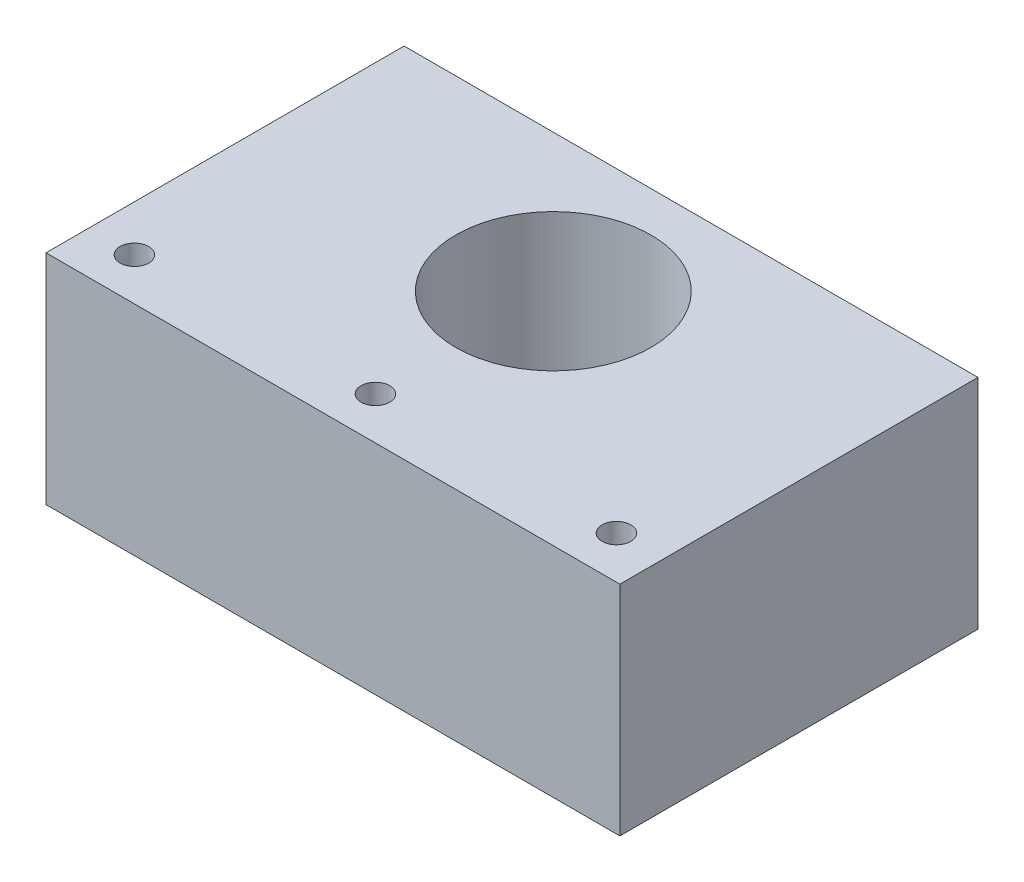
from build123d import *

# Parameters (mm, degrees)
SKETCH1_W           = 63.5
SKETCH1_H           = 25.4
BOSS_EXTRUDE1_DEPTH = 38.1
SKETCH2_R           = 3.175
CUT_EXTRUDE1_DEPTH  = 12.7
SKETCH2_3_R         = 8.763
CUT_EXTRUDE2_DEPTH  = 4.826
CUT_EXTRUDE3_START  = -20.574
SKETCH3_R           = 6.35
CUT_EXTRUDE3_DEPTH  = 20.574
SKETCH4_R           = 10.795
CUT_EXTRUDE4_DEPTH  = 19.05
SKETCH5_R           = 1.5875
CUT_EXTRUDE5_DEPTH  = 50.8
SKETCH6_W           = 63.5
SKETCH6_H           = 1.27
CUT_EXTRUDE6_DEPTH  = 38.1
SKETCH7_W           = 63.5
SKETCH7_H           = 24.13
BOSS_EXTRUDE2_DEPTH = 1.524


with BuildPart() as part:
    # Sketch1 → Boss-Extrude1 (new body)
    with BuildSketch(Plane.XY):
        Rectangle(SKETCH1_W, SKETCH1_H)
    extrude(amount=BOSS_EXTRUDE1_DEPTH)

    # Sketch2 → Cut-Extrude1 (cut)
    with BuildSketch(Plane.XZ.offset(12.7)):
        with Locations(Location((-24.765, 15.24, 0), (0, 0, 270))):
            Circle(SKETCH2_R)
        with Locations(Location((24.765, 15.24, 0), (0, 0, 270))):
            Circle(SKETCH2_R)
    extrude(amount=-CUT_EXTRUDE1_DEPTH, mode=Mode.SUBTRACT)

    # Sketch2<3> → Cut-Extrude2 (cut)
    with BuildSketch(Plane.XZ.offset(12.7)):
        with Locations(Location((0, 15.24, 0), (0, 0, 270))):
            Circle(SKETCH2_3_R)
    extrude(amount=-CUT_EXTRUDE2_DEPTH, mode=Mode.SUBTRACT)

    # Sketch3 → Cut-Extrude3 (cut)
    with BuildSketch(Plane.XZ.offset(7.874).offset(CUT_EXTRUDE3_START)):
        with Locations(Location((0, 15.24, 0), (0, 0, 270))):
            Circle(SKETCH3_R)
    extrude(amount=CUT_EXTRUDE3_DEPTH, mode=Mode.SUBTRACT)

    # Sketch4 → Cut-Extrude4 (cut)
    with BuildSketch(Plane(origin=(0, 12.7, 0), x_dir=(1, 0, 0), z_dir=(0, 1, 0))):
        with Locations(Location((0, -15.24, 0), (0, 0, 270))):
            Circle(SKETCH4_R)
    extrude(amount=-CUT_EXTRUDE4_DEPTH, mode=Mode.SUBTRACT)

    # Sketch5 → Cut-Extrude5 (cut)
    with BuildSketch(Plane(origin=(0, 12.7, 0), x_dir=(1, 0, 0), z_dir=(0, 1, 0))):
        with Locations(Location((-26.67, -34.925, 0), (0, 0, 270))):
            Circle(SKETCH5_R)
        with Locations(Location((0, -34.925, 0), (0, 0, 270))):
            Circle(SKETCH5_R)
        with Locations(Location((26.67, -34.925, 0), (0, 0, 270))):
            Circle(SKETCH5_R)
    extrude(amount=-CUT_EXTRUDE5_DEPTH, mode=Mode.SUBTRACT)

    # Sketch6 → Cut-Extrude6 (cut)
    with BuildSketch(Plane.XY.offset(38.1)):
        with Locations((0, -12.065)):
            Rectangle(SKETCH6_W, SKETCH6_H)
    extrude(amount=-CUT_EXTRUDE6_DEPTH, mode=Mode.SUBTRACT)

    # Sketch7 → Boss-Extrude2 (add)
    with BuildSketch(Plane.XY.offset(38.1)):
        with Locations((0, 0.635)):
            Rectangle(SKETCH7_W, SKETCH7_H)
    extrude(amount=BOSS_EXTRUDE2_DEPTH)


solid = part.part
